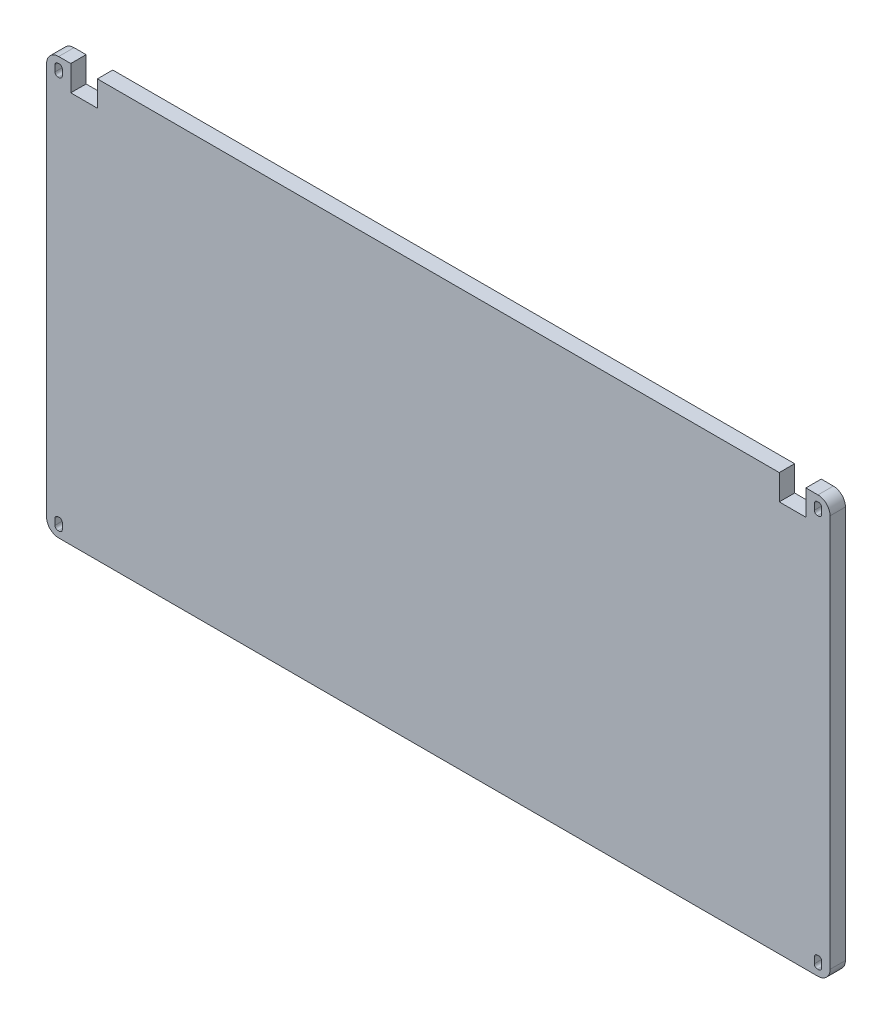
from build123d import *

# Parameters (mm, degrees)
BOSS_EXTRUDE1_DEPTH = 12.7
FILLET1_R           = 10


with BuildPart() as part:
    # Sketch1 → Boss-Extrude1 (new body)
    with BuildSketch(Plane.XY):
        Polygon((305.725145069, 169.700104384), (325.725145069, 169.700104384), (325.725145069, -174.977895616), (-321.974854931, -174.977895616), (-321.974854931, 169.700104384), (-301.974854931, 169.700104384), (-301.974854931, 148.700104384), (-279.974854931, 148.700104384), (-279.974854931, 169.700104384), (283.725145069, 169.700104384), (283.725145069, 148.700104384), (305.725145069, 148.700104384), align=None)
        with BuildLine():
            Line((316.225145069, -169.977895616), (315.225145069, -169.977895616))
            ThreePointArc((315.225145069, -169.977895616), (313.457378116, -169.245662569), (312.725145069, -167.477895616))
            Line((312.725145069, -167.477895616), (312.725145069, -162.477895616))
            ThreePointArc((312.725145069, -162.477895616), (313.457378116, -160.710128663), (315.225145069, -159.977895616))
            Line((315.225145069, -159.977895616), (316.225145069, -159.977895616))
            ThreePointArc((316.225145069, -159.977895616), (317.992912022, -160.710128663), (318.725145069, -162.477895616))
            Line((318.725145069, -162.477895616), (318.725145069, -167.477895616))
            ThreePointArc((318.725145069, -167.477895616), (317.992912022, -169.245662569), (316.225145069, -169.977895616))
        make_face(mode=Mode.SUBTRACT)
        with BuildLine():
            Line((-311.474854931, -169.977895616), (-312.474854931, -169.977895616))
            ThreePointArc((-312.474854931, -169.977895616), (-314.242621884, -169.245662569), (-314.974854931, -167.477895616))
            Line((-314.974854931, -167.477895616), (-314.974854931, -162.477895616))
            ThreePointArc((-314.974854931, -162.477895616), (-314.242621884, -160.710128663), (-312.474854931, -159.977895616))
            Line((-312.474854931, -159.977895616), (-311.474854931, -159.977895616))
            ThreePointArc((-311.474854931, -159.977895616), (-309.707087978, -160.710128663), (-308.974854931, -162.477895616))
            Line((-308.974854931, -162.477895616), (-308.974854931, -167.477895616))
            ThreePointArc((-308.974854931, -167.477895616), (-309.707087978, -169.245662569), (-311.474854931, -169.977895616))
        make_face(mode=Mode.SUBTRACT)
        with BuildLine():
            Line((-311.474854931, 154.702104384), (-312.474854931, 154.702104384))
            ThreePointArc((-312.474854931, 154.702104384), (-314.242621884, 155.434337431), (-314.974854931, 157.202104384))
            Line((-314.974854931, 157.202104384), (-314.974854931, 162.202104384))
            ThreePointArc((-314.974854931, 162.202104384), (-314.242621884, 163.969871337), (-312.474854931, 164.702104384))
            Line((-312.474854931, 164.702104384), (-311.474854931, 164.702104384))
            ThreePointArc((-311.474854931, 164.702104384), (-309.707087978, 163.969871337), (-308.974854931, 162.202104384))
            Line((-308.974854931, 162.202104384), (-308.974854931, 157.202104384))
            ThreePointArc((-308.974854931, 157.202104384), (-309.707087978, 155.434337431), (-311.474854931, 154.702104384))
        make_face(mode=Mode.SUBTRACT)
        with BuildLine():
            Line((316.225145069, 154.702104384), (315.225145069, 154.702104384))
            ThreePointArc((315.225145069, 154.702104384), (313.457378116, 155.434337431), (312.725145069, 157.202104384))
            Line((312.725145069, 157.202104384), (312.725145069, 162.202104384))
            ThreePointArc((312.725145069, 162.202104384), (313.457378116, 163.969871337), (315.225145069, 164.702104384))
            Line((315.225145069, 164.702104384), (316.225145069, 164.702104384))
            ThreePointArc((316.225145069, 164.702104384), (317.992912022, 163.969871337), (318.725145069, 162.202104384))
            Line((318.725145069, 162.202104384), (318.725145069, 157.202104384))
            ThreePointArc((318.725145069, 157.202104384), (317.992912022, 155.434337431), (316.225145069, 154.702104384))
        make_face(mode=Mode.SUBTRACT)
    extrude(amount=BOSS_EXTRUDE1_DEPTH)

    # Fillet1
    fillet1_edges = [part.edges().sort_by_distance(p)[0] for p in [
        (-321.974854931, 169.700104384, 6.35),
        (-321.974854931, -174.977895616, 6.35),
        (325.725145069, -174.977895616, 6.35),
        (325.725145069, 169.700104384, 6.35),
    ]]
    fillet(fillet1_edges, radius=FILLET1_R)


solid = part.part
